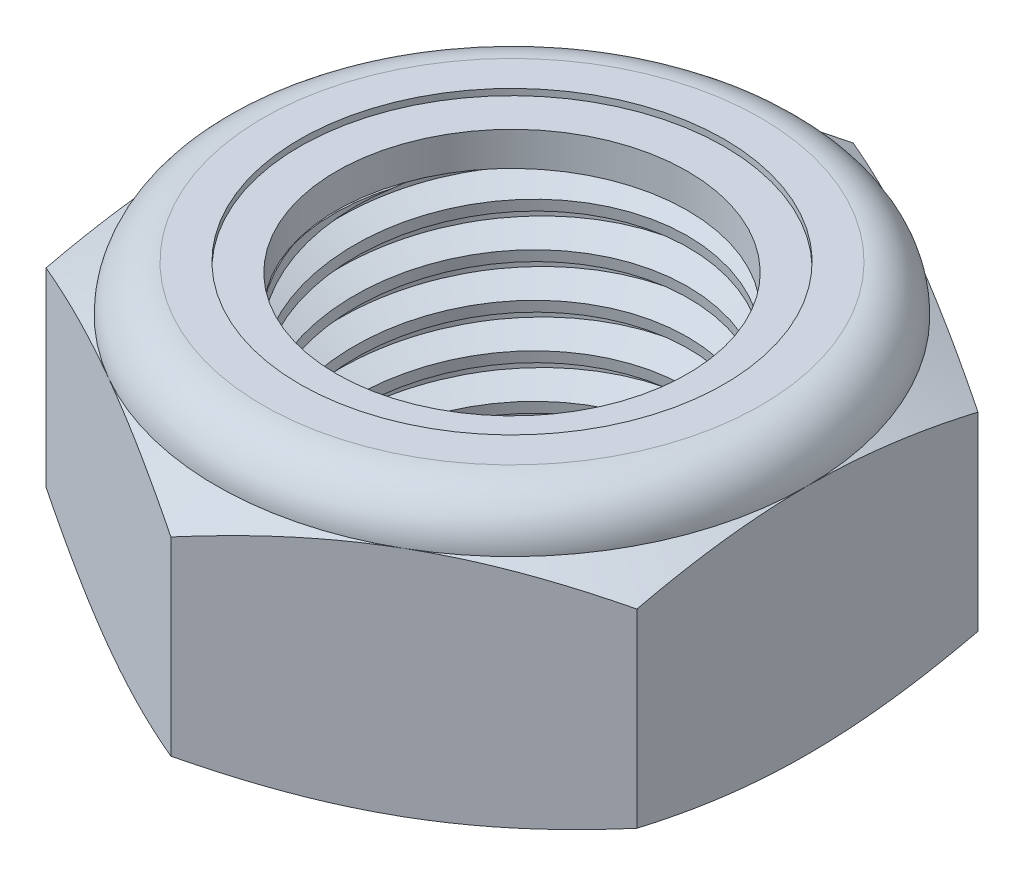
from build123d import *

# Parameters (mm, degrees)
EXTRUDE1_DEPTH      = 6.746875
SKETCH2_W           = 4.7625
SKETCH2_H           = 6.746875
LPATTERN1_COUNT     = 6
LPATTERN1_PITCH     = 1.058333333
LPATTERN1_COL_COUNT = 2
LPATTERN1_COL_PITCH = 1.058333333


with BuildPart() as part:
    # Sketch1 → Extrude1 (new body)
    with BuildSketch(Plane(origin=(0, 0, 0), x_dir=(1, 0, 0), z_dir=(0, 1, 0))):
        Polygon((0, 8.248891971), (-7.14375, 4.124445986), (-7.14375, -4.124445986), (0, -8.248891971), (7.14375, -4.124445986), (7.14375, 4.124445986), align=None)
    extrude(amount=EXTRUDE1_DEPTH)

    # Sketch4 → Cut-Revolve2 (revolve, cut)
    with BuildSketch(Plane(origin=(0, 0, 0), x_dir=(0, 0, -1), z_dir=(1, 0, 0)), mode=Mode.PRIVATE) as cut_revolve2_sk:
        Polygon((0, 6.746875), (4.7625, 6.746875), (4.244296017, 6.505232514), (4.244296017, 0.241642486), (4.7625, 0), (0, 0), align=None)
    revolve(cut_revolve2_sk.sketch.rotate(Axis((0, 6.746875, 0), (0, 1, 0)), 54.723003925), axis=Axis((0, 6.746875, 0), (0, 1, 0)), mode=Mode.SUBTRACT)


with BuildPart() as body_2:
    # Sketch2 → Revolve1 (revolve)
    with BuildSketch(Plane(origin=(0, 0, 0), x_dir=(0, 0, -1), z_dir=(1, 0, 0))):
        with Locations((2.38125, 3.3734375)):
            Rectangle(SKETCH2_W, SKETCH2_H)
    revolve(axis=Axis((0, -4.7625, 0), (0, 1, 0)))

    # Sketch3 → Cut-Revolve1 (revolve, cut)
    with BuildSketch(Plane(origin=(0, 0, 0), x_dir=(0, 0, -1), z_dir=(1, 0, 0)), mode=Mode.PRIVATE) as cut_revolve1_sk:
        Polygon((4.777109171, 6.615392464), (4.879373365, 5.695014714), (4.273514358, 5.960461489), (4.244296017, 6.22342656), align=None)
    cut_revolve1 = revolve(cut_revolve1_sk.sketch.rotate(Axis((0, 6.746875, 0.125349185), (0, -0.9938837346736189, -0.11043152607484667)), 180), axis=Axis((0, 6.746875, 0.125349185), (0, -0.9938837346736189, -0.11043152607484667)), mode=Mode.SUBTRACT)

    # LPattern1: Cut-Revolve1 ×6
    with Locations(*[(0, -i * LPATTERN1_PITCH, 0) for i in range(1, LPATTERN1_COUNT)]):
        add(cut_revolve1, mode=Mode.SUBTRACT)

    # LPattern1 col: Cut-Revolve1 ×2
    with Locations(*[(0, i * LPATTERN1_COL_PITCH, 0) for i in range(1, LPATTERN1_COL_COUNT)]):
        add(cut_revolve1, mode=Mode.SUBTRACT)


with BuildPart() as part_1:
    add(part.part)

    # Combine1: cut body 2
    add(body_2.part, mode=Mode.SUBTRACT)

    # Sketch5 → Cut-Revolve3 (revolve, cut)
    with BuildSketch(Plane(origin=(0, 0, 0), x_dir=(0, 0, -1), z_dir=(1, 0, 0)), mode=Mode.PRIVATE) as cut_revolve3_sk:
        with BuildLine():
            Line((0, 0), (7.14375, 0))
            Line((7.14375, 0), (8.248891971, 0.515336164))
            Line((8.248891971, 0.515336164), (8.248891971, 5.107059669))
            Line((8.248891971, 5.107059669), (7.14375, 5.622395833))
            ThreePointArc((7.14375, 5.622395833), (6.814397677, 6.417522677), (6.019270833, 6.746875))
            Line((6.019270833, 6.746875), (6.019270833, 8.016875))
            Line((6.019270833, 8.016875), (9.518891971, 8.016875))
            Line((9.518891971, 8.016875), (9.518891971, -1.27))
            Line((9.518891971, -1.27), (0, -1.27))
            Line((0, -1.27), (0, 0))
        make_face()
    revolve(cut_revolve3_sk.sketch.rotate(Axis((0, 0, 0), (0, 1, 0)), 54.723003925), axis=Axis((0, 0, 0), (0, 1, 0)), mode=Mode.SUBTRACT)

    # Sketch6 → Cut-Revolve4 (revolve, cut)
    with BuildSketch(Plane(origin=(0, 0, 0), x_dir=(0, 0, -1), z_dir=(1, 0, 0)), mode=Mode.PRIVATE) as cut_revolve4_sk:
        with BuildLine():
            Line((0, 5.622395833), (6.99135, 5.622395833))
            ThreePointArc((6.99135, 5.622395833), (6.706634604, 6.309759604), (6.019270833, 6.594475))
            Line((6.019270833, 6.594475), (5.131783425, 6.594475))
            Line((5.131783425, 6.594475), (5.131783425, 8.016875))
            Line((5.131783425, 8.016875), (0, 8.016875))
            Line((0, 8.016875), (0, 5.622395833))
        make_face()
    revolve(cut_revolve4_sk.sketch.rotate(Axis((0, 8.016875, 0), (0, 1, 0)), 54.723003925), axis=Axis((0, 8.016875, 0), (0, 1, 0)), mode=Mode.SUBTRACT)


with BuildPart() as body_2_2:
    # Sketch7 → Revolve2 (revolve)
    with BuildSketch(Plane(origin=(0, 0, 0), x_dir=(0, 0, -1), z_dir=(1, 0, 0))):
        with BuildLine():
            Line((4.244296017, 5.698595833), (6.91190348, 5.698595833))
            ThreePointArc((6.91190348, 5.698595833), (6.625213689, 6.282269107), (6.019270833, 6.518275))
            Line((6.019270833, 6.518275), (4.244296017, 6.518275))
            Line((4.244296017, 6.518275), (4.244296017, 5.698595833))
        make_face()
    revolve(axis=Axis((0, 5.698595833, 0), (0, 1, 0)))


solid = Compound([part_1.part, body_2_2.part])
